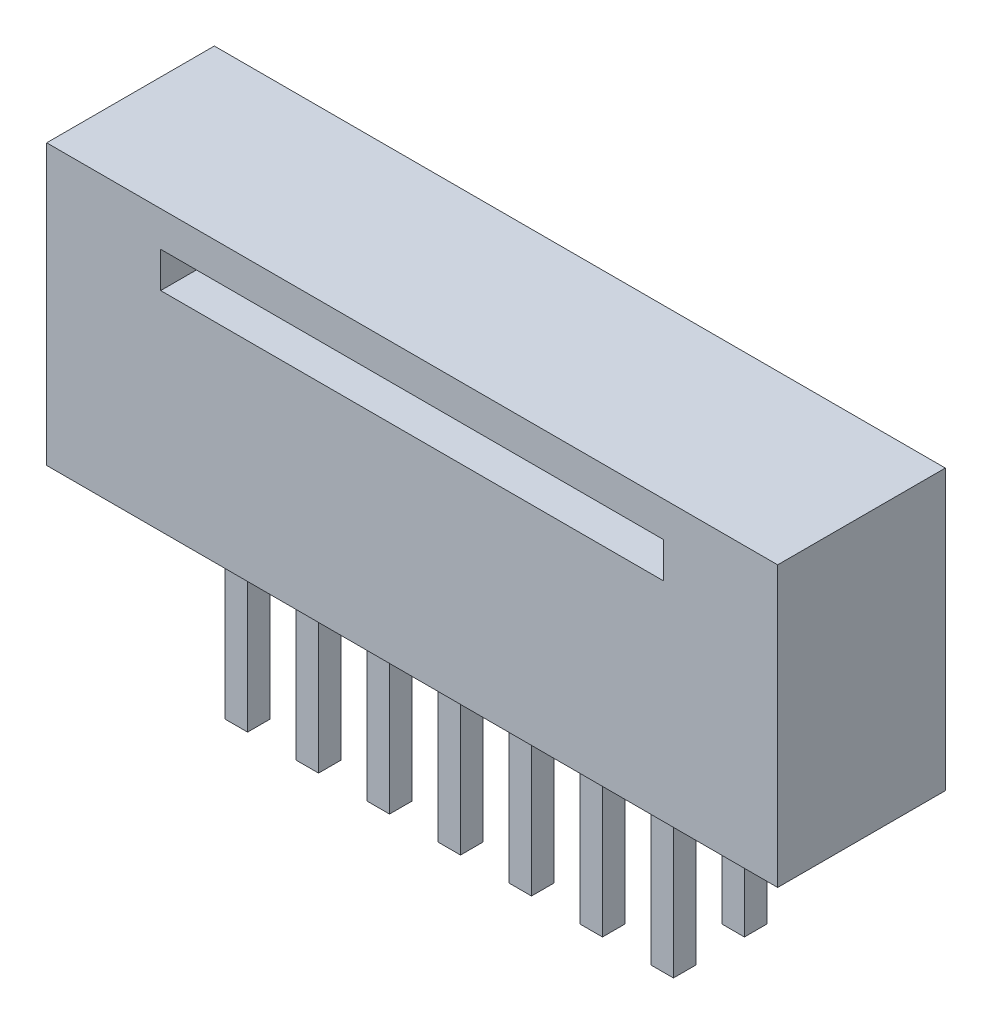
from build123d import *

# Parameters (mm, degrees)
SKETCH1_W              = 0.4
SKETCH1_H              = 0.4
BOSS_EXTRUDE1_DEPTH    = 3
BOSS_EXTRUDE1_2_DEPTH  = 3
BOSS_EXTRUDE1_3_DEPTH  = 3
BOSS_EXTRUDE1_4_DEPTH  = 3
BOSS_EXTRUDE1_5_DEPTH  = 3
BOSS_EXTRUDE1_6_DEPTH  = 3
BOSS_EXTRUDE1_7_DEPTH  = 3
BOSS_EXTRUDE1_8_DEPTH  = 3
BOSS_EXTRUDE1_9_DEPTH  = 3
BOSS_EXTRUDE1_10_DEPTH = 3
BOSS_EXTRUDE1_11_DEPTH = 3
BOSS_EXTRUDE1_12_DEPTH = 3
BOSS_EXTRUDE1_13_DEPTH = 3
BOSS_EXTRUDE1_14_DEPTH = 3
SKETCH2_W              = 13.08
SKETCH2_H              = 3
BOSS_EXTRUDE2_DEPTH    = 5
SKETCH3_W              = 9
SKETCH3_H              = 0.64
CUT_EXTRUDE1_DEPTH     = 9.761940424


with BuildPart() as part:
    # Sketch1 → Boss-Extrude1 (new body)
    with BuildSketch(Plane(origin=(0, 0, 0), x_dir=(1, 0, 0), z_dir=(0, 1, 0))):
        with Locations((-2.54, -0.635)):
            Rectangle(SKETCH1_W, SKETCH1_H)
    extrude(amount=-BOSS_EXTRUDE1_DEPTH)



with BuildPart() as body_2:
    # Sketch1 → Boss-Extrude1 2 (new body)
    with BuildSketch(Plane(origin=(0, 0, 0), x_dir=(1, 0, 0), z_dir=(0, 1, 0))):
        with Locations((-3.81, -0.635)):
            Rectangle(SKETCH1_W, SKETCH1_H)
    extrude(amount=-BOSS_EXTRUDE1_2_DEPTH)


with BuildPart() as body_3:
    # Sketch1 → Boss-Extrude1 3 (new body)
    with BuildSketch(Plane(origin=(0, 0, 0), x_dir=(1, 0, 0), z_dir=(0, 1, 0))):
        with Locations((-1.27, -0.635)):
            Rectangle(SKETCH1_W, SKETCH1_H)
    extrude(amount=-BOSS_EXTRUDE1_3_DEPTH)


with BuildPart() as body_4:
    # Sketch1 → Boss-Extrude1 4 (new body)
    with BuildSketch(Plane(origin=(0, 0, 0), x_dir=(1, 0, 0), z_dir=(0, 1, 0))):
        with Locations((0, -0.635)):
            Rectangle(SKETCH1_W, SKETCH1_H)
    extrude(amount=-BOSS_EXTRUDE1_4_DEPTH)


with BuildPart() as body_5:
    # Sketch1 → Boss-Extrude1 5 (new body)
    with BuildSketch(Plane(origin=(0, 0, 0), x_dir=(1, 0, 0), z_dir=(0, 1, 0))):
        with Locations((1.27, -0.635)):
            Rectangle(SKETCH1_W, SKETCH1_H)
    extrude(amount=-BOSS_EXTRUDE1_5_DEPTH)


with BuildPart() as body_6:
    # Sketch1 → Boss-Extrude1 6 (new body)
    with BuildSketch(Plane(origin=(0, 0, 0), x_dir=(1, 0, 0), z_dir=(0, 1, 0))):
        with Locations((2.54, -0.635)):
            Rectangle(SKETCH1_W, SKETCH1_H)
    extrude(amount=-BOSS_EXTRUDE1_6_DEPTH)


with BuildPart() as body_7:
    # Sketch1 → Boss-Extrude1 7 (new body)
    with BuildSketch(Plane(origin=(0, 0, 0), x_dir=(1, 0, 0), z_dir=(0, 1, 0))):
        with Locations((3.81, -0.635)):
            Rectangle(SKETCH1_W, SKETCH1_H)
    extrude(amount=-BOSS_EXTRUDE1_7_DEPTH)


with BuildPart() as body_8:
    # Sketch1 → Boss-Extrude1 8 (new body)
    with BuildSketch(Plane(origin=(0, 0, 0), x_dir=(1, 0, 0), z_dir=(0, 1, 0))):
        with Locations((-2.54, 0.635)):
            Rectangle(SKETCH1_W, SKETCH1_H)
    extrude(amount=-BOSS_EXTRUDE1_8_DEPTH)


with BuildPart() as body_9:
    # Sketch1 → Boss-Extrude1 9 (new body)
    with BuildSketch(Plane(origin=(0, 0, 0), x_dir=(1, 0, 0), z_dir=(0, 1, 0))):
        with Locations((-1.27, 0.635)):
            Rectangle(SKETCH1_W, SKETCH1_H)
    extrude(amount=-BOSS_EXTRUDE1_9_DEPTH)


with BuildPart() as body_10:
    # Sketch1 → Boss-Extrude1 10 (new body)
    with BuildSketch(Plane(origin=(0, 0, 0), x_dir=(1, 0, 0), z_dir=(0, 1, 0))):
        with Locations((0, 0.635)):
            Rectangle(SKETCH1_W, SKETCH1_H)
    extrude(amount=-BOSS_EXTRUDE1_10_DEPTH)


with BuildPart() as body_11:
    # Sketch1 → Boss-Extrude1 11 (new body)
    with BuildSketch(Plane(origin=(0, 0, 0), x_dir=(1, 0, 0), z_dir=(0, 1, 0))):
        with Locations((1.27, 0.635)):
            Rectangle(SKETCH1_W, SKETCH1_H)
    extrude(amount=-BOSS_EXTRUDE1_11_DEPTH)


with BuildPart() as body_12:
    # Sketch1 → Boss-Extrude1 12 (new body)
    with BuildSketch(Plane(origin=(0, 0, 0), x_dir=(1, 0, 0), z_dir=(0, 1, 0))):
        with Locations((2.54, 0.635)):
            Rectangle(SKETCH1_W, SKETCH1_H)
    extrude(amount=-BOSS_EXTRUDE1_12_DEPTH)


with BuildPart() as body_13:
    # Sketch1 → Boss-Extrude1 13 (new body)
    with BuildSketch(Plane(origin=(0, 0, 0), x_dir=(1, 0, 0), z_dir=(0, 1, 0))):
        with Locations((3.81, 0.635)):
            Rectangle(SKETCH1_W, SKETCH1_H)
    extrude(amount=-BOSS_EXTRUDE1_13_DEPTH)


with BuildPart() as body_14:
    # Sketch1 → Boss-Extrude1 14 (new body)
    with BuildSketch(Plane(origin=(0, 0, 0), x_dir=(1, 0, 0), z_dir=(0, 1, 0))):
        with Locations((-3.81, 0.635)):
            Rectangle(SKETCH1_W, SKETCH1_H)
    extrude(amount=-BOSS_EXTRUDE1_14_DEPTH)


with BuildPart() as part_1:
    add(part.part)

    add(body_2.part)  # Boss-Extrude2 merges body 2

    add(body_3.part)  # Boss-Extrude2 merges body 3

    add(body_4.part)  # Boss-Extrude2 merges body 4

    add(body_5.part)  # Boss-Extrude2 merges body 5

    add(body_6.part)  # Boss-Extrude2 merges body 6

    add(body_7.part)  # Boss-Extrude2 merges body 7

    add(body_8.part)  # Boss-Extrude2 merges body 8

    add(body_9.part)  # Boss-Extrude2 merges body 9

    add(body_10.part)  # Boss-Extrude2 merges body 10

    add(body_11.part)  # Boss-Extrude2 merges body 11

    add(body_12.part)  # Boss-Extrude2 merges body 12

    add(body_13.part)  # Boss-Extrude2 merges body 13

    add(body_14.part)  # Boss-Extrude2 merges body 14
    # Sketch2 → Boss-Extrude2 (add)
    with BuildSketch(Plane(origin=(0, 0, 0), x_dir=(1, 0, 0), z_dir=(0, 1, 0))):
        Rectangle(SKETCH2_W, SKETCH2_H)
    extrude(amount=BOSS_EXTRUDE2_DEPTH)

    # Sketch3 → Cut-Extrude1 (cut, through all)
    with BuildSketch(Plane.XY.offset(1.5)):
        with Locations((0, 4.05)):
            Rectangle(SKETCH3_W, SKETCH3_H)
    extrude(amount=-CUT_EXTRUDE1_DEPTH, mode=Mode.SUBTRACT)


solid = part_1.part
